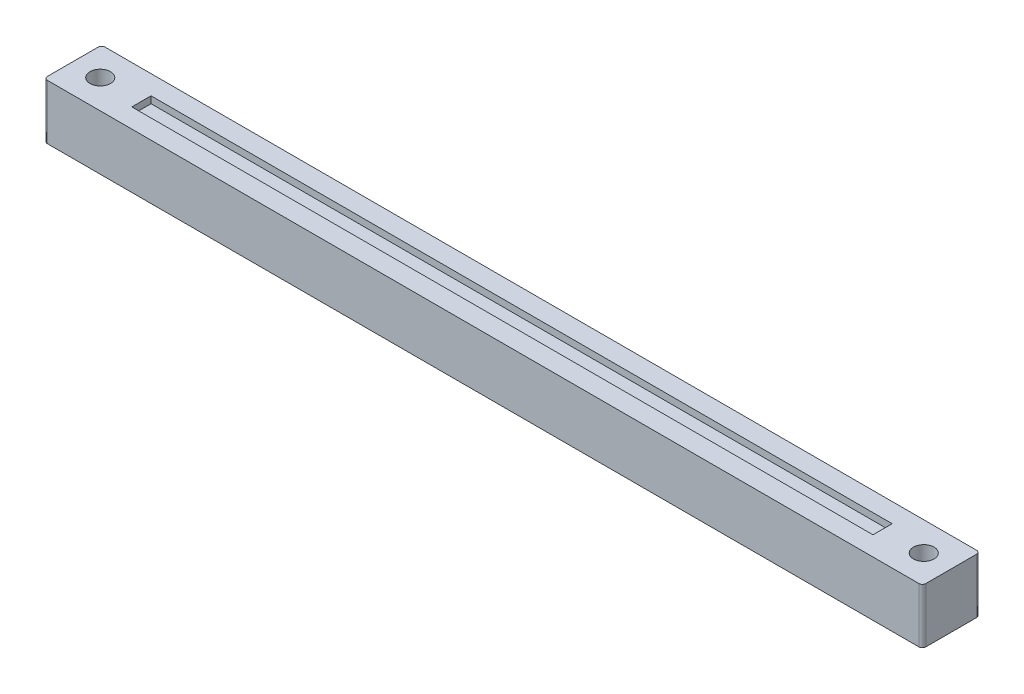
from build123d import *

# Parameters (mm, degrees)
SKETCH1_W           = 128
SKETCH1_H           = 8.4
BOSS_EXTRUDE1_DEPTH = 8
SKETCH2_R           = 1.5
CUT_EXTRUDE1_DEPTH  = 65.634665621
SKETCH3_W           = 108
SKETCH3_H           = 2.8
CUT_EXTRUDE2_DEPTH  = 1
FILLET1_R           = 0.5


with BuildPart() as part:
    # Sketch1 → Boss-Extrude1 (new body)
    with BuildSketch(Plane(origin=(0, 0, 0), x_dir=(1, 0, 0), z_dir=(0, 1, 0))):
        Rectangle(SKETCH1_W, SKETCH1_H)
    extrude(amount=BOSS_EXTRUDE1_DEPTH)

    # Sketch2 → Cut-Extrude1 (cut, through all)
    with BuildSketch(Plane(origin=(0, 8, 0), x_dir=(1, 0, 0), z_dir=(0, 1, 0))):
        with Locations(Location((-60, 0, 0), (0, 0, 270))):
            Circle(SKETCH2_R)
        with Locations(Location((60, 0, 0), (0, 0, 90))):
            Circle(SKETCH2_R)
    extrude(amount=-CUT_EXTRUDE1_DEPTH, mode=Mode.SUBTRACT)

    # Sketch3 → Cut-Extrude2 (cut)
    with BuildSketch(Plane(origin=(0, 8, 0), x_dir=(1, 0, 0), z_dir=(0, 1, 0))):
        Rectangle(SKETCH3_W, SKETCH3_H)
    extrude(amount=-CUT_EXTRUDE2_DEPTH, mode=Mode.SUBTRACT)

    # Fillet1
    fillet1_edges = [part.edges().sort_by_distance(p)[0] for p in [
        (64, 4, 4.2),
        (-64, 4, 4.2),
        (-64, 4, -4.2),
        (64, 4, -4.2),
    ]]
    fillet(fillet1_edges, radius=FILLET1_R)


solid = part.part
